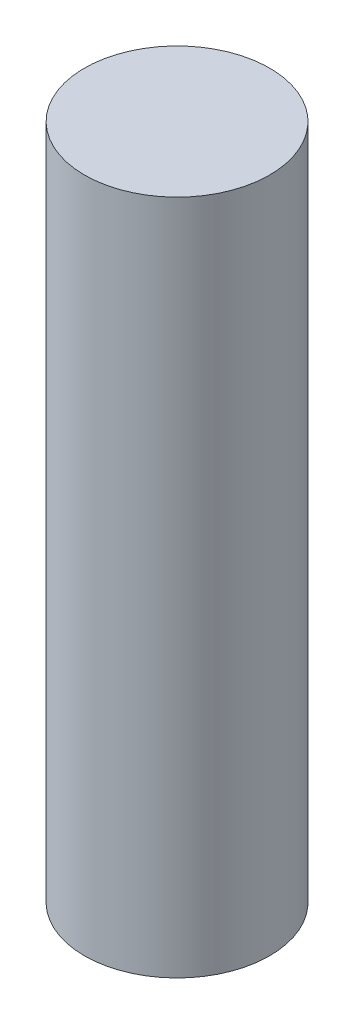
from build123d import *

# Parameters (mm, degrees)
ESQUISSE1_R        = 3.15
BOSS_EXTRU_1_DEPTH = 11.5


with BuildPart() as part:
    # Esquisse1 → Boss.-Extru.1 (new, symmetric)
    with BuildSketch(Plane(origin=(0, 0, 0), x_dir=(1, 0, 0), z_dir=(0, 1, 0))):
        with Locations(Location((0, 0, 0), (0, 0, 270))):
            Circle(ESQUISSE1_R)
    extrude(amount=BOSS_EXTRU_1_DEPTH, both=True)


solid = part.part
